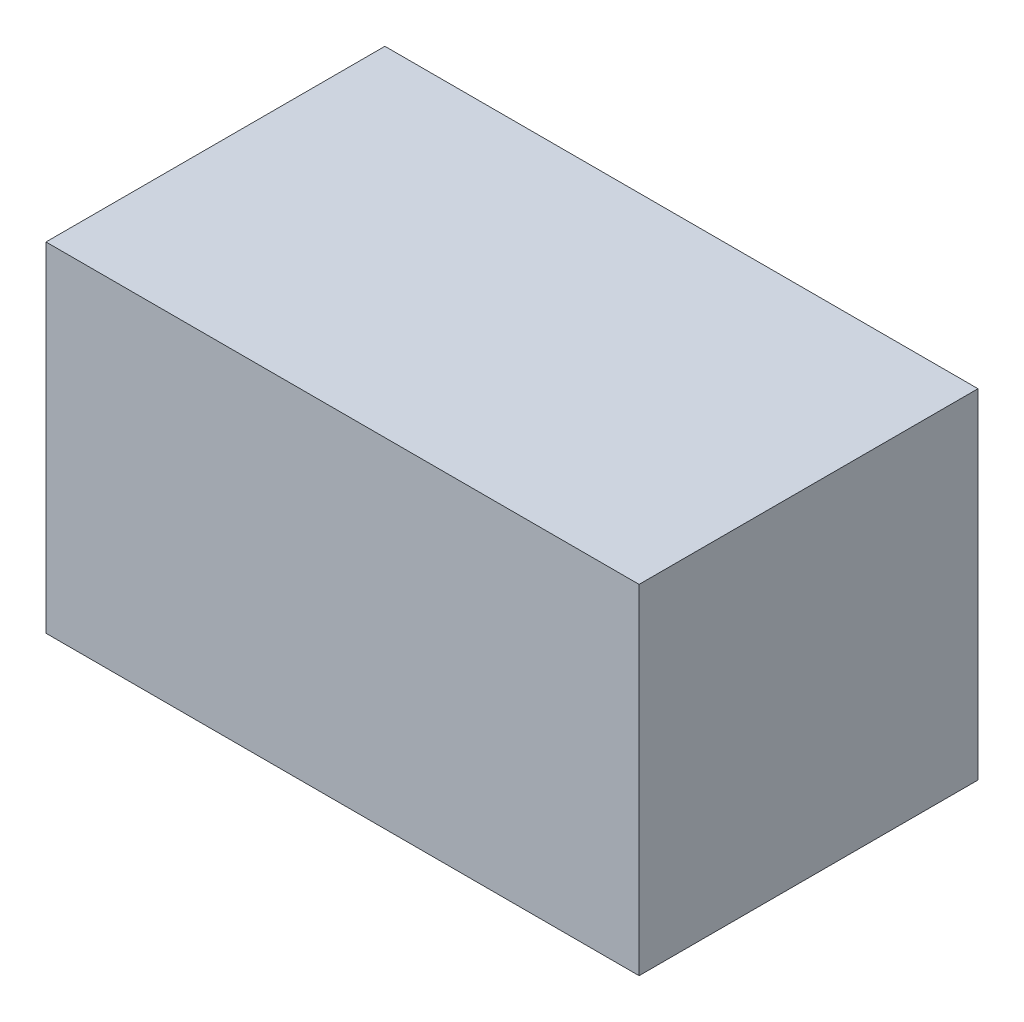
from build123d import *

# Parameters (mm, degrees)
SKETCH1_W           = 88.9
SKETCH1_H           = 50.8
BOSS_EXTRUDE2_DEPTH = 50.8


with BuildPart() as part:
    # Sketch1 → Boss-Extrude2 (new body)
    with BuildSketch(Plane(origin=(0, 0, 0), x_dir=(1, 0, 0), z_dir=(0, 1, 0))):
        Rectangle(SKETCH1_W, SKETCH1_H)
    extrude(amount=BOSS_EXTRUDE2_DEPTH)


solid = part.part
